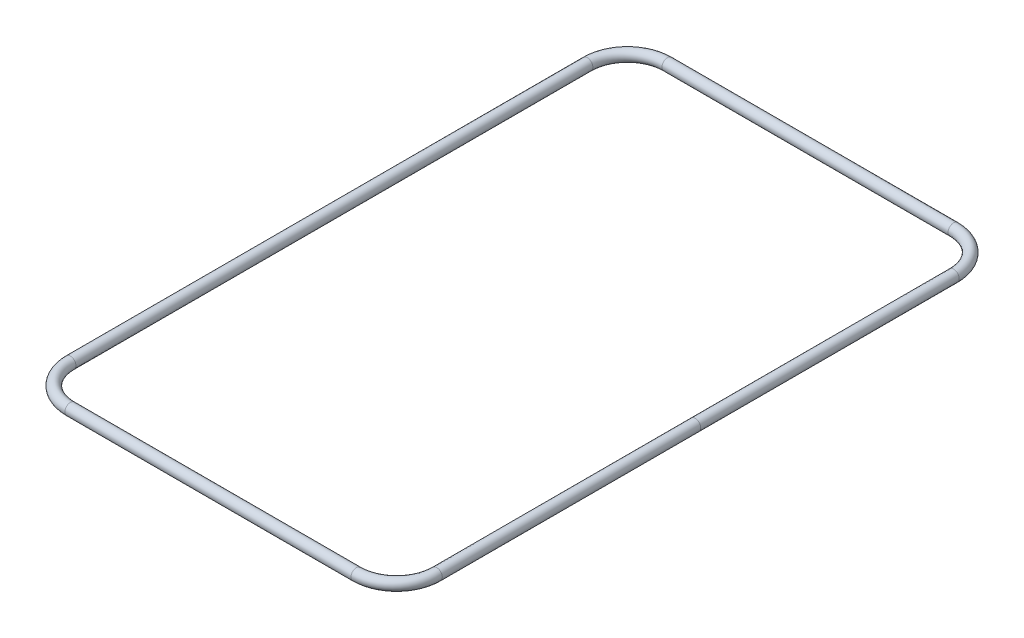
from build123d import *

# Parameters (mm, degrees)
O_RINGPROFILE_R = 1.7653


with BuildPart() as part:
    # Sweep2: sweep along a path in O-RingPath
    with BuildLine(Plane(origin=(0, 0, 0), x_dir=(1, 0, 0), z_dir=(0, 1, 0))) as sweep2_path:
        Line((45.29650165, -94.5388), (-45.29650165, -94.5388))
        ThreePointArc((-45.29650165, -94.5388), (-54.276757771, -90.819056121), (-57.99650165, -81.8388))
        Line((-57.99650165, -81.8388), (-57.99650165, 81.8388))
        ThreePointArc((-57.99650165, 81.8388), (-54.276757771, 90.819056121), (-45.29650165, 94.5388))
        Line((-45.29650165, 94.5388), (45.29650165, 94.5388))
        ThreePointArc((45.29650165, 94.5388), (54.276757771, 90.819056121), (57.99650165, 81.8388))
        Line((57.99650165, 81.8388), (57.99650165, -81.8388))
        ThreePointArc((57.99650165, -81.8388), (54.276757771, -90.819056121), (45.29650165, -94.5388))
    # O-RingProfile → Sweep2 (sweep)
    with BuildSketch(Plane.XY):
        with Locations((57.99650165, 0)):
            Circle(O_RINGPROFILE_R)
    sweep(path=sweep2_path.line)


solid = part.part
